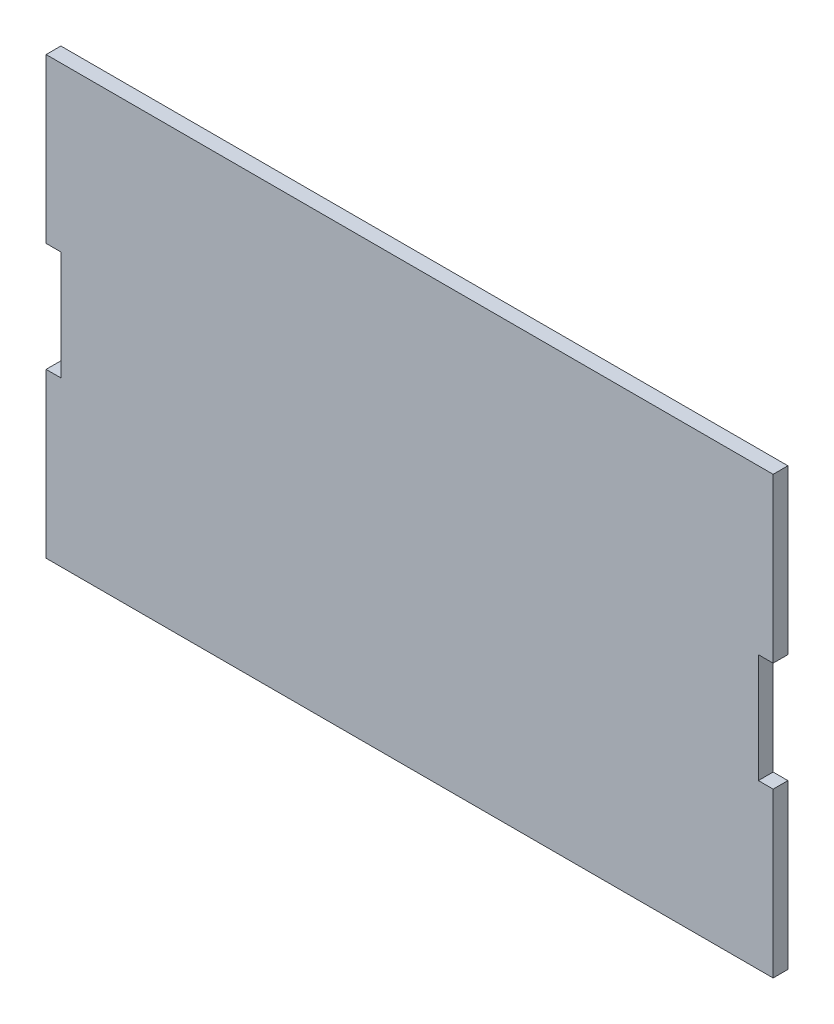
from build123d import *

# Parameters (mm, degrees)
BOSS_EXTRUDE1_DEPTH = 10.16


with BuildPart() as part:
    # Sketch1 → Boss-Extrude1 (new body)
    with BuildSketch(Plane.XY):
        Polygon((-250, -150), (250, -150), (250, -37.5), (239.84, -37.5), (239.84, 37.5), (250, 37.5), (250, 150), (-250, 150), (-250, 37.5), (-239.84, 37.5), (-239.84, -37.5), (-250, -37.5), align=None)
    extrude(amount=BOSS_EXTRUDE1_DEPTH)


solid = part.part
